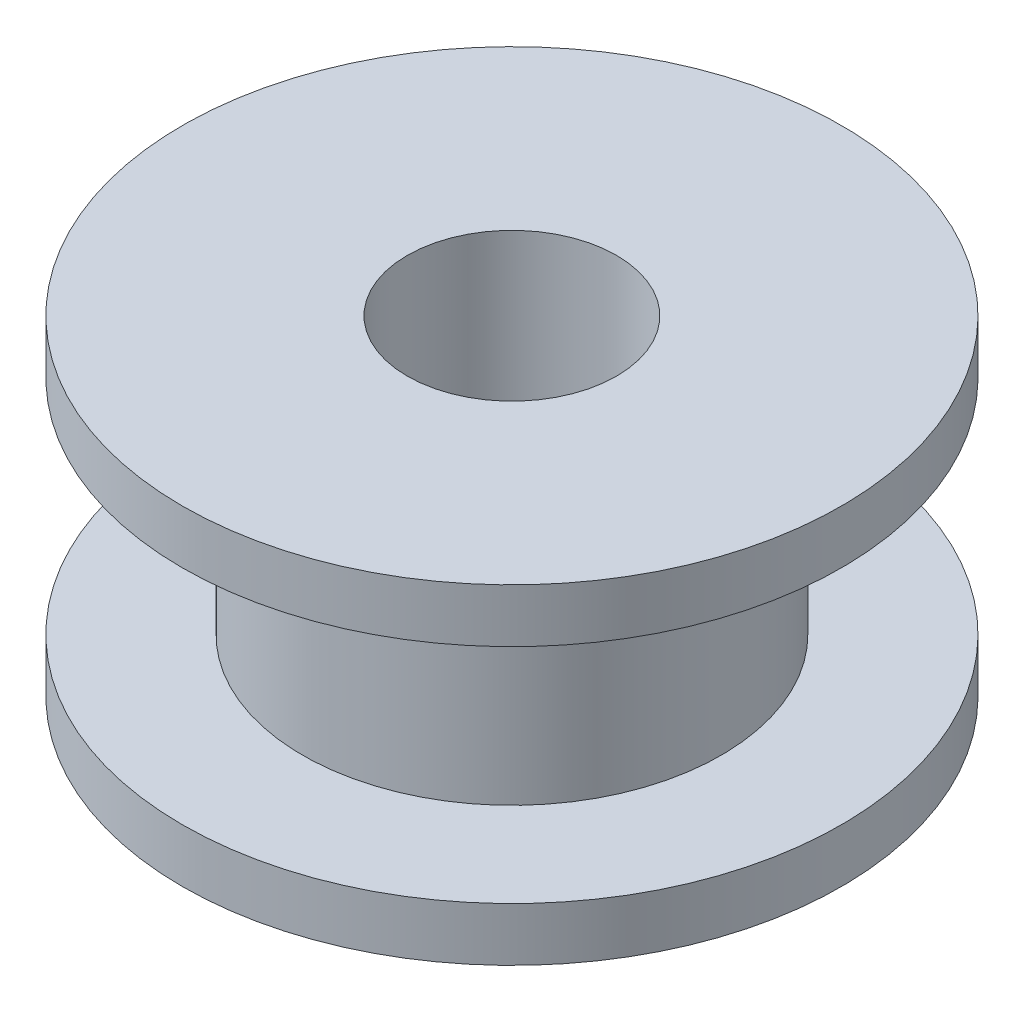
from build123d import *

# Parameters (mm, degrees)
SKETCH1_R           = 8
SKETCH1_R_2         = 2.54
BOSS_EXTRUDE1_DEPTH = 8
SKETCH2_R           = 8
SKETCH2_R_2         = 5.08
CUT_EXTRUDE1_DEPTH  = 5.4


with BuildPart() as part:
    # Sketch1 → Boss-Extrude1 (new body)
    with BuildSketch(Plane(origin=(0, 0, 0), x_dir=(1, 0, 0), z_dir=(0, 1, 0))):
        with Locations(Location((0, 0, 0), (0, 0, 270))):
            Circle(SKETCH1_R)
        with Locations(Location((0, 0, 0), (0, 0, 270))):
            Circle(SKETCH1_R_2, mode=Mode.SUBTRACT)
    extrude(amount=BOSS_EXTRUDE1_DEPTH)

    # Sketch2 → Cut-Extrude1 (cut)
    with BuildSketch(Plane(origin=(0, 1.3, 0), x_dir=(1, 0, 0), z_dir=(0, 1, 0))):
        with Locations(Location((0, 0, 0), (0, 0, 270))):
            Circle(SKETCH2_R)
        with Locations(Location((0, 0, 0), (0, 0, 90))):
            Circle(SKETCH2_R_2, mode=Mode.SUBTRACT)
    extrude(amount=CUT_EXTRUDE1_DEPTH, mode=Mode.SUBTRACT)


solid = part.part
